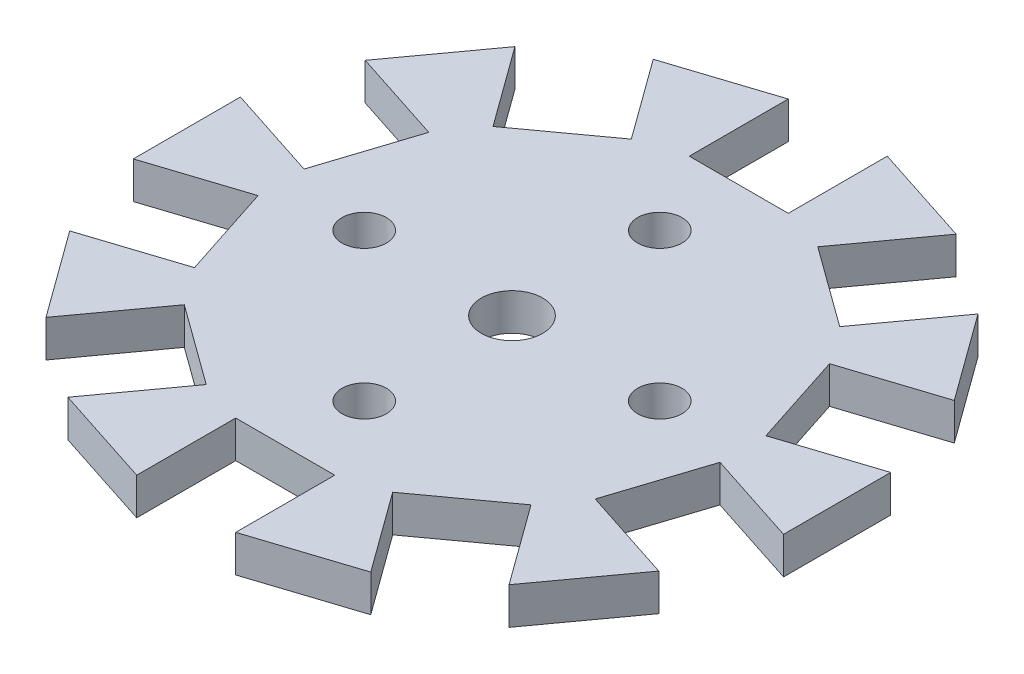
from build123d import *

# Parameters (mm, degrees)
BOSS_EXTRUDE1_DEPTH = 2.5
CUT_EXTRUDE1_DEPTH  = 2.5
SKETCH7_R           = 1.5
CUT_EXTRUDE3_DEPTH  = 2.5
SKETCH10_R          = 2.075
CUT_EXTRUDE6_DEPTH  = 2.5


with BuildPart() as part:
    # Sketch1 → Boss-Extrude1 (new body)
    with BuildSketch(Plane(origin=(0, 0, 0), x_dir=(1, 0, 0), z_dir=(0, 1, 0))):
        Polygon((0, 23.132168933), (-13.596747752, 18.714317784), (-22, 7.148233317), (-22, -7.148233317), (-13.596747752, -18.714317784), (0, -23.132168933), (13.596747752, -18.714317784), (22, -7.148233317), (22, 7.148233317), (13.596747752, 18.714317784), align=None)
    extrude(amount=BOSS_EXTRUDE1_DEPTH)

    # Sketch2 → Cut-Extrude1 (cut)
    with BuildSketch(Plane(origin=(0, 2.5, 0), x_dir=(1, 0, 0), z_dir=(0, 1, 0))):
        Polygon((0, 23.132168933), (-3.35, 22.043687951), (-3.35, 15.343687951), (3.35, 15.343687951), (3.35, 22.043687951), align=None)
        Polygon((11.729000424, 10.444223713), (15.667161615, 15.864637576), (13.596747752, 18.714317784), (10.246747752, 19.802798766), (6.308586562, 14.382384904), align=None)
        Polygon((15.627921341, 1.555421004), (22, 3.625834866), (22, 7.148233317), (19.929586138, 9.997913525), (13.557507479, 7.927499663), align=None)
        Polygon((13.557507479, -7.927499663), (19.929586138, -9.997913525), (22, -7.148233317), (22, -3.625834866), (15.627921341, -1.555421004), align=None)
        Polygon((6.308586562, -14.382384904), (10.246747752, -19.802798766), (13.596747752, -18.714317784), (15.667161615, -15.864637576), (11.729000424, -10.444223713), align=None)
        Polygon((-3.35, -15.343687951), (-3.35, -22.043687951), (0, -23.132168933), (3.35, -22.043687951), (3.35, -15.343687951), align=None)
        Polygon((-11.729000424, -10.444223713), (-15.667161615, -15.864637576), (-13.596747752, -18.714317784), (-10.246747752, -19.802798766), (-6.308586562, -14.382384904), align=None)
        Polygon((-15.627921341, -1.555421004), (-22, -3.625834866), (-22, -7.148233317), (-19.929586138, -9.997913525), (-13.557507479, -7.927499663), align=None)
        Polygon((-13.557507479, 7.927499663), (-19.929586138, 9.997913525), (-22, 7.148233317), (-22, 3.625834866), (-15.627921341, 1.555421004), align=None)
        Polygon((-6.308586562, 14.382384904), (-10.246747752, 19.802798766), (-13.596747752, 18.714317784), (-15.667161615, 15.864637576), (-11.729000424, 10.444223713), align=None)
    extrude(amount=-CUT_EXTRUDE1_DEPTH, mode=Mode.SUBTRACT)

    # Sketch7 → Cut-Extrude3 (cut)
    with BuildSketch(Plane(origin=(0, 2.5, 0), x_dir=(1, 0, 0), z_dir=(0, 1, 0))):
        with Locations(Location((0, 10, 0), (0, 0, 270))):
            Circle(SKETCH7_R)
        with Locations(Location((10, 0, 0), (0, 0, 270))):
            Circle(SKETCH7_R)
        with Locations(Location((0, -10, 0), (0, 0, 270))):
            Circle(SKETCH7_R)
        with Locations(Location((-10, 0, 0), (0, 0, 270))):
            Circle(SKETCH7_R)
    extrude(amount=-CUT_EXTRUDE3_DEPTH, mode=Mode.SUBTRACT)

    # Sketch10 → Cut-Extrude6 (cut)
    with BuildSketch(Plane(origin=(0, 2.5, 0), x_dir=(1, 0, 0), z_dir=(0, 1, 0))):
        with Locations(Location((0, 0, 0), (0, 0, 270))):
            Circle(SKETCH10_R)
    extrude(amount=-CUT_EXTRUDE6_DEPTH, mode=Mode.SUBTRACT)


solid = part.part
